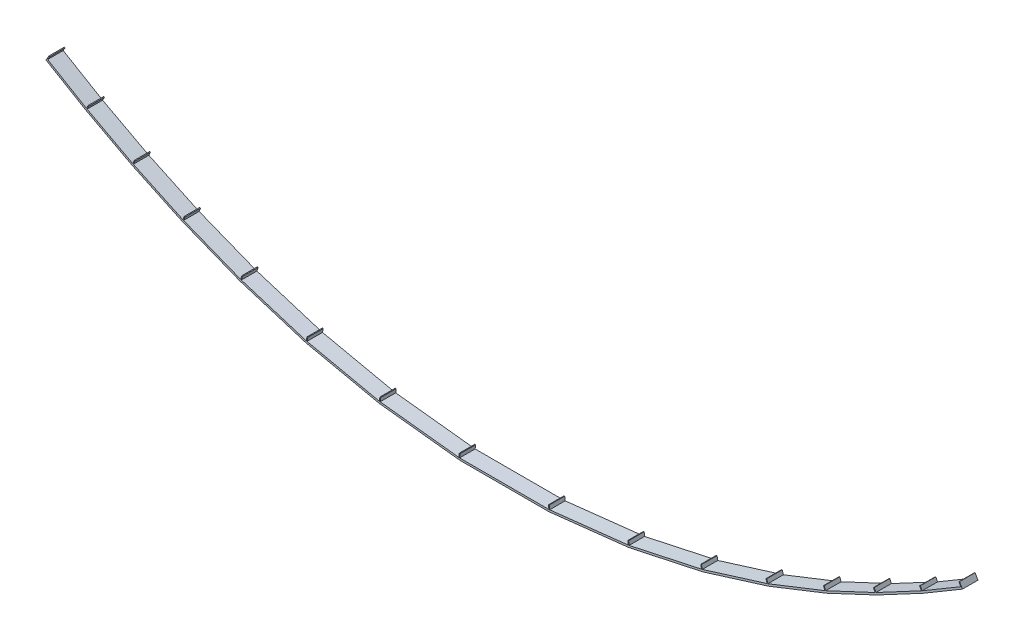
from build123d import *

# Parameters (mm, degrees)
EXTRUDE_1_DEPTH = 40
EXTRUDE_2_DEPTH = 40


with BuildPart() as part:
    # 草图1 → 凸台-拉伸1 (new body)
    with BuildSketch(Plane.XY):
        Polygon((-115, 0), (115, 0), (115, -5), (-115.278668015, -5), (-322.519573187, 18.17254404), (-511.63276316, 59.025714898), (-681.043594869, 111.694020512), (-830.167599932, 170.615996068), (-959.898827689, 231.441774436), (-1079.263175746, 295.015855057), (-1180.937012969, 355.121645311), (-1178.392557068, 359.425799603), (-1076.814515779, 299.376640342), (-957.66086644, 235.914778968), (-828.185710586, 175.209062462), (-679.380389192, 116.413005408), (-510.360191041, 63.866144258), (-321.711807872, 23.113383276), align=None)
    extrude_1 = extrude(amount=EXTRUDE_1_DEPTH)

    # 草图2 → 凸台-拉伸2 (add)
    with BuildSketch(Plane.XY.offset(40)):
        Polygon((-115, 0), (-113.88877965, 9.938067686), (-115.876393187, 10.160311756), (-116.987613537, 0.22224407), align=None)
        Polygon((-321.711807872, 23.113383276), (-320.600587522, 33.051450962), (-318.612973985, 32.829206892), (-319.724194334, 22.891139206), align=None)
        Polygon((-510.360191041, 63.866144258), (-508.248649021, 73.640671883), (-506.293743496, 73.21836348), (-508.405285516, 63.443835854), align=None)
        Polygon((-679.380389192, 116.413005408), (-676.411639975, 125.962169146), (-674.501807228, 125.368419302), (-677.470556445, 115.819255565), align=None)
        Polygon((-828.185710586, 175.209062462), (-824.51095702, 184.509395049), (-822.650890502, 183.774444336), (-826.325644068, 174.474111749), align=None)
        Polygon((-957.66086644, 235.914778968), (-953.41571144, 244.968985671), (-951.604870099, 244.119954671), (-955.850025099, 235.065747968), align=None)
        Polygon((-1076.814515779, 299.376640342), (-1072.113637159, 308.20283659), (-1070.34839791, 307.262660865), (-1075.04927653, 298.436464618), align=None)
        Polygon((-1178.392557068, 359.425799603), (-1173.303645267, 368.034108187), (-1171.58198355, 367.016325826), (-1176.670895352, 358.408017242), align=None)
    extrude_2 = extrude(amount=-EXTRUDE_2_DEPTH)

    # 镜向1: 凸台-拉伸1, 凸台-拉伸2 across plane
    add(extrude_1.mirror(Plane(origin=(0, 0, 0), x_dir=(0, 0, 1), z_dir=(1, 0, 0))))
    add(extrude_2.mirror(Plane(origin=(0, 0, 0), x_dir=(0, 0, 1), z_dir=(1, 0, 0))))


solid = part.part
